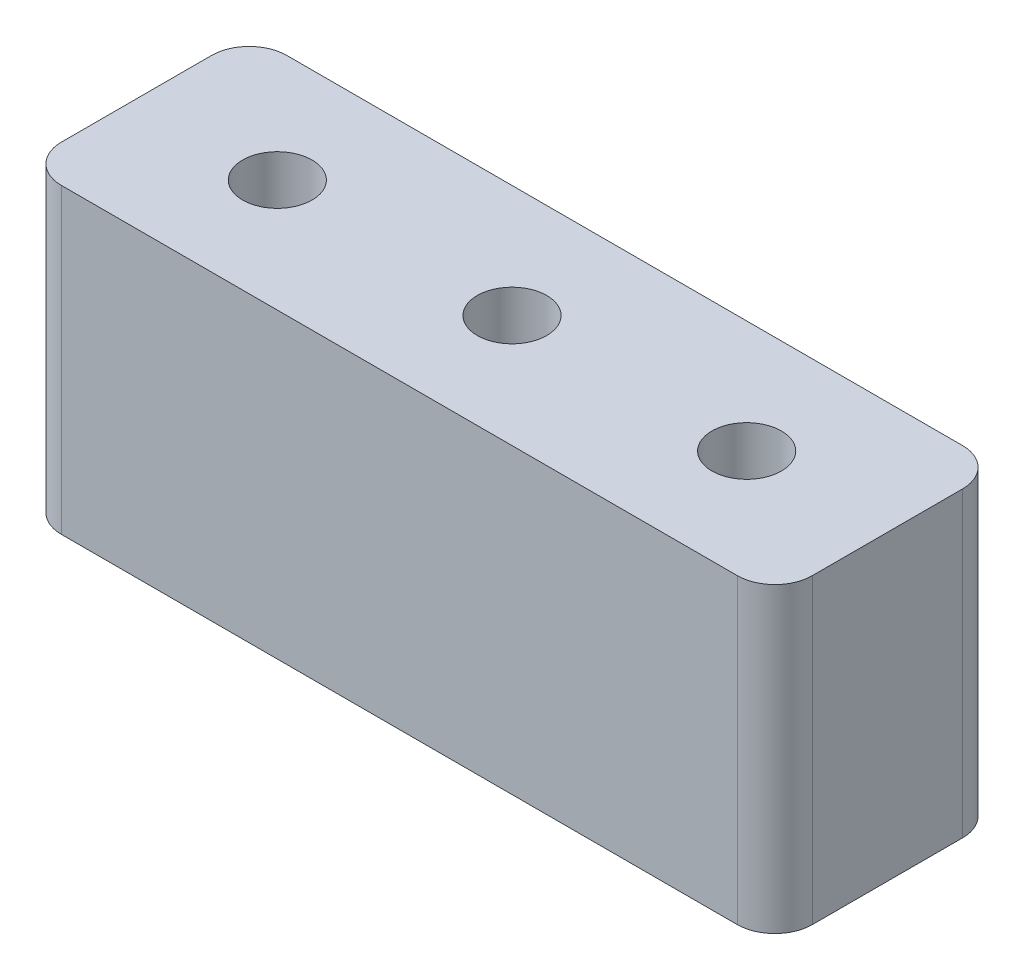
from build123d import *

# Parameters (mm, degrees)
SKETCH_1_W          = 40
SKETCH_1_H          = 12
SKETCH_1_R          = 1.85
EXTRUDE_1_DEPTH     = 16.1
FILLET_1_R          = 2
SKETCH_2_R          = 1.85
CUT_EXTRUDE_1_DEPTH = 20


with BuildPart() as part:
    # 草图1 → 凸台-拉伸1 (new body)
    with BuildSketch(Plane(origin=(0, 0, 0), x_dir=(1, 0, 0), z_dir=(0, 1, 0))):
        Rectangle(SKETCH_1_W, SKETCH_1_H)
        with Locations(Location((-12.5, 0, 0), (0, 0, 270))):
            Circle(SKETCH_1_R, mode=Mode.SUBTRACT)
        with Locations(Location((12.5, 0, 0), (0, 0, 270))):
            Circle(SKETCH_1_R, mode=Mode.SUBTRACT)
    extrude(amount=EXTRUDE_1_DEPTH)

    # 圆角1
    fillet_1_edges = [part.edges().sort_by_distance(p)[0] for p in [
        (20, 8.05, 6),
        (-20, 8.05, 6),
        (-20, 8.05, -6),
        (20, 8.05, -6),
    ]]
    fillet(fillet_1_edges, radius=FILLET_1_R)

    # 草图2 → 切除-拉伸1 (cut)
    with BuildSketch(Plane(origin=(0, 16.1, 0), x_dir=(1, 0, 0), z_dir=(0, 1, 0))):
        with Locations(Location((0, 0, 0), (0, 0, 270))):
            Circle(SKETCH_2_R)
    extrude(amount=-CUT_EXTRUDE_1_DEPTH, mode=Mode.SUBTRACT)


solid = part.part
